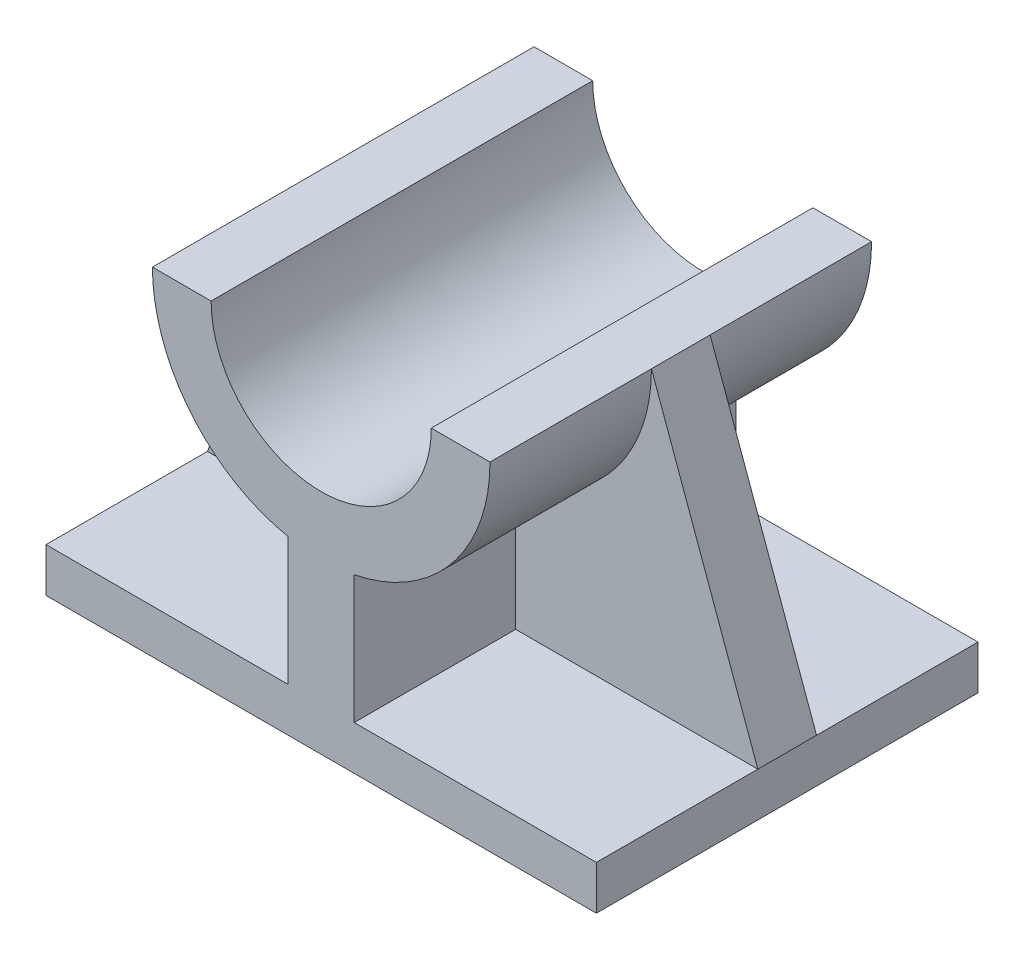
from build123d import *

# Parameters (mm, degrees)
BOSS_EXTRUDE1_DEPTH = 26
RIB1_REACH          = 64.7
SKETCH2_WALL_W      = 169.946394838
SKETCH2_WALL_H      = 8


with BuildPart() as part:
    # Sketch1 → Boss-Extrude1 (new, symmetric)
    with BuildSketch(Plane.XY):
        with BuildLine():
            Line((-23, 43), (-15, 43))
            ThreePointArc((-15, 43), (0, 28), (15, 43))
            Line((15, 43), (23, 43))
            ThreePointArc((23, 43), (17.783419244, 28.414047854), (4.5, 20.444512863))
            Line((4.5, 20.444512863), (4.5, 3))
            Line((4.5, 3), (37.5, 3))
            Line((37.5, 3), (37.5, -3))
            Line((37.5, -3), (-37.5, -3))
            Line((-37.5, -3), (-37.5, 3))
            Line((-37.5, 3), (-4.5, 3))
            Line((-4.5, 3), (-4.5, 20.444512863))
            ThreePointArc((-4.5, 20.444512863), (-17.783419244, 28.414047854), (-23, 43))
        make_face()
    extrude(amount=BOSS_EXTRUDE1_DEPTH, both=True)

    # Sketch2 wall → Rib1 (add, up to next)
    with BuildSketch(Plane(origin=(30.25, 23, 0), x_dir=(0.340799323621, -0.940136065162, 0), z_dir=(0.940136065162, 0.340799323621, 0)), mode=Mode.PRIVATE) as rib1_sk1:
        Rectangle(SKETCH2_WALL_W, SKETCH2_WALL_H)
    rib1_tool1 = extrude(rib1_sk1.sketch, amount=-RIB1_REACH, mode=Mode.PRIVATE) - part.part
    rib1 = rib1_tool1.solids().sort_by_distance((30.25, 23, 0))[0]
    add(rib1)

    # Mirror1: Rib1 across plane
    add(rib1.mirror(Plane(origin=(0, 0, 0), x_dir=(0, 0, 1), z_dir=(1, 0, 0))))


solid = part.part
